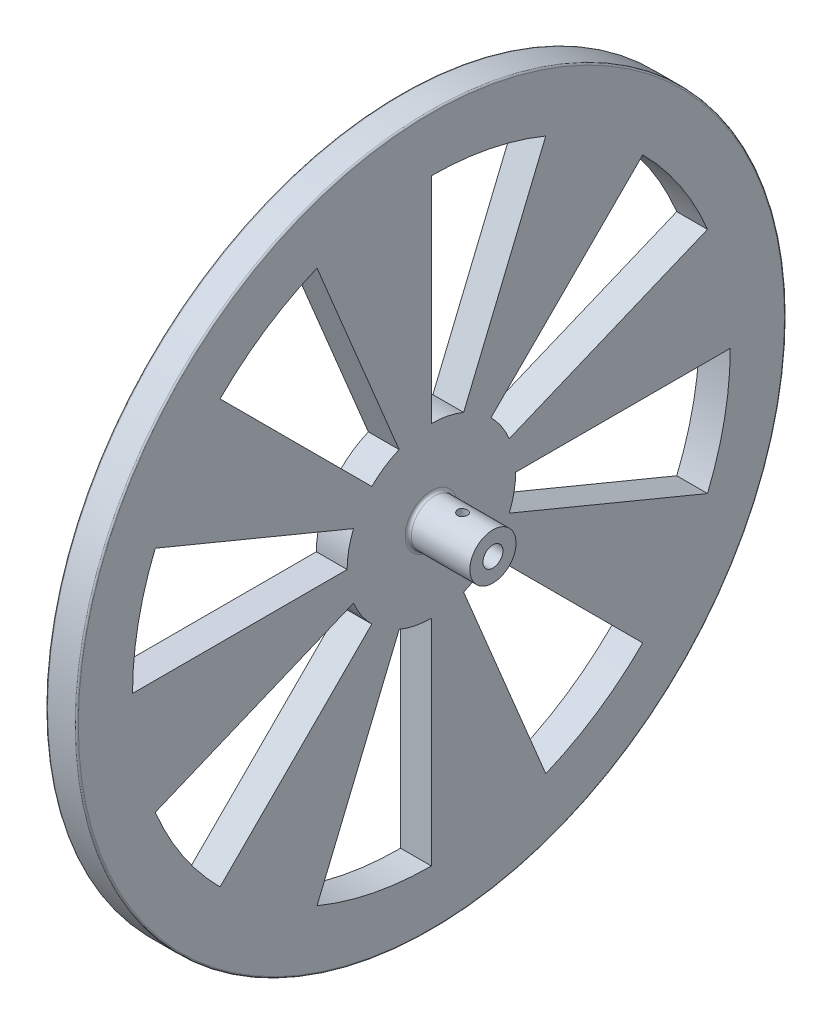
from build123d import *

# Parameters (mm, degrees)
SKETCH1_R           = 115.22
BOSS_EXTRUDE1_DEPTH = 10
FILLET1_R           = 0.5
CUT_EXTRUDE1_DEPTH  = 10
SKETCH3_R           = 7.5
BOSS_EXTRUDE2_DEPTH = 20
FILLET3_R           = 1
SKETCH4_R           = 3.25
CUT_EXTRUDE2_DEPTH  = 20
SKETCH5_R           = 1.6
CUT_EXTRUDE4_DEPTH  = 20


with BuildPart() as part:
    # Sketch1 → Boss-Extrude1 (new body)
    with BuildSketch(Plane(origin=(0, 0, 0), x_dir=(0, 0, -1), z_dir=(1, 0, 0))):
        Circle(SKETCH1_R)
    extrude(amount=BOSS_EXTRUDE1_DEPTH)

    # Fillet1
    fillet1_edges = [part.edges().sort_by_distance(p)[0] for p in [
        (0, 0, 115.22),
        (10, 0, 115.22),
    ]]
    fillet(fillet1_edges, radius=FILLET1_R)

    # Sketch2 → Cut-Extrude1 (cut)
    with BuildSketch(Plane(origin=(10, 0, 0), x_dir=(0, 0, -1), z_dir=(1, 0, 0))):
        with BuildLine():
            Line((-89.710835252, 37.159444653), (-25.292265207, 10.476399272))
            ThreePointArc((-25.292265207, 10.476399272), (-26.850125531, 5.340822034), (-27.376150588, 0))
            Line((-27.376150588, 0), (-97.102308359, 0))
            ThreePointArc((-97.102308359, 0), (-95.236514731, 18.943720606), (-89.710835252, 37.159444653))
        make_face()
        with BuildLine():
            Line((-68.661700709, 68.661700709), (-19.357861723, 19.357861723))
            ThreePointArc((-19.357861723, 19.357861723), (-15.209374361, 22.762437316), (-10.476399272, 25.292265207))
            Line((-10.476399272, 25.292265207), (-37.159444653, 89.710835252))
            ThreePointArc((-37.159444653, 89.710835252), (-53.947152082, 80.737618685), (-68.661700709, 68.661700709))
        make_face()
        with BuildLine():
            Line((0, 97.102308359), (0, 27.376150588))
            ThreePointArc((0, 27.376150588), (5.340822034, 26.850125531), (10.476399272, 25.292265207))
            Line((10.476399272, 25.292265207), (37.159444653, 89.710835252))
            ThreePointArc((37.159444653, 89.710835252), (18.943720606, 95.236514731), (0, 97.102308359))
        make_face()
        with BuildLine():
            Line((68.661700709, 68.661700709), (19.357861723, 19.357861723))
            ThreePointArc((19.357861723, 19.357861723), (22.762437316, 15.209374361), (25.292265207, 10.476399272))
            Line((25.292265207, 10.476399272), (89.710835252, 37.159444653))
            ThreePointArc((89.710835252, 37.159444653), (80.737618685, 53.947152082), (68.661700709, 68.661700709))
        make_face()
        with BuildLine():
            Line((97.102308359, 0), (27.376150588, 0))
            ThreePointArc((27.376150588, 0), (26.850125531, -5.340822034), (25.292265207, -10.476399272))
            Line((25.292265207, -10.476399272), (89.710835252, -37.159444653))
            ThreePointArc((89.710835252, -37.159444653), (95.236514731, -18.943720606), (97.102308359, 0))
        make_face()
        with BuildLine():
            Line((68.661700709, -68.661700709), (19.357861723, -19.357861723))
            ThreePointArc((19.357861723, -19.357861723), (15.209374361, -22.762437316), (10.476399272, -25.292265207))
            Line((10.476399272, -25.292265207), (37.159444653, -89.710835252))
            ThreePointArc((37.159444653, -89.710835252), (53.947152082, -80.737618685), (68.661700709, -68.661700709))
        make_face()
        with BuildLine():
            Line((0, -97.102308359), (0, -27.376150588))
            ThreePointArc((0, -27.376150588), (-5.340822034, -26.850125531), (-10.476399272, -25.292265207))
            Line((-10.476399272, -25.292265207), (-37.159444653, -89.710835252))
            ThreePointArc((-37.159444653, -89.710835252), (-18.943720606, -95.236514731), (0, -97.102308359))
        make_face()
        with BuildLine():
            Line((-68.661700709, -68.661700709), (-19.357861723, -19.357861723))
            ThreePointArc((-19.357861723, -19.357861723), (-22.762437316, -15.209374361), (-25.292265207, -10.476399272))
            Line((-25.292265207, -10.476399272), (-89.710835252, -37.159444653))
            ThreePointArc((-89.710835252, -37.159444653), (-80.737618685, -53.947152082), (-68.661700709, -68.661700709))
        make_face()
    extrude(amount=-CUT_EXTRUDE1_DEPTH, mode=Mode.SUBTRACT)

    # Sketch3 → Boss-Extrude2 (add)
    with BuildSketch(Plane(origin=(10, 0, 0), x_dir=(0, 0, -1), z_dir=(1, 0, 0))):
        Circle(SKETCH3_R)
    extrude(amount=BOSS_EXTRUDE2_DEPTH)

    # Fillet3
    fillet3_edges = [part.edges().sort_by_distance(p)[0] for p in [
        (10, 0, 7.5),
    ]]
    fillet(fillet3_edges, radius=FILLET3_R)

    # Sketch4 → Cut-Extrude2 (cut)
    with BuildSketch(Plane(origin=(30, 0, 0), x_dir=(0, 0, -1), z_dir=(1, 0, 0))):
        Circle(SKETCH4_R)
    extrude(amount=-CUT_EXTRUDE2_DEPTH, mode=Mode.SUBTRACT)

    # Sketch5 → Cut-Extrude4 (cut)
    with BuildSketch(Plane(origin=(0, 0, 0), x_dir=(1, 0, 0), z_dir=(0, 1, 0))):
        with Locations(Location((20.158087078, 0, 0), (0, 0, 90))):
            Circle(SKETCH5_R)
    extrude(amount=CUT_EXTRUDE4_DEPTH, mode=Mode.SUBTRACT)


solid = part.part
